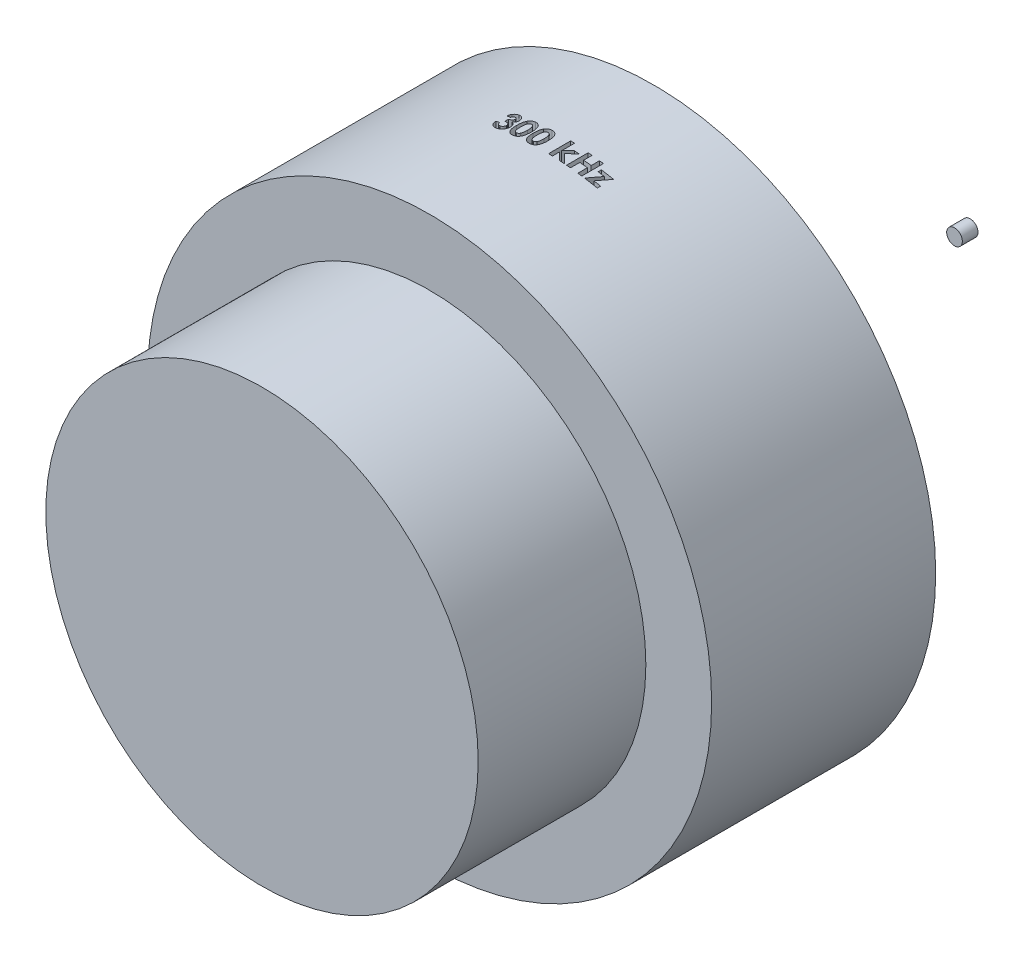
from build123d import *

# Parameters (mm, degrees)
SKETCH1_W          = 2.54
SKETCH1_H          = 1.27
CUT_EXTRUDE1_START = 50.8
CUT_EXTRUDE1_DEPTH = 12.7


with BuildPart() as part:
    # Sketch1 → Revolve1 (revolve)
    with BuildSketch(Plane(origin=(0, 0, 0), x_dir=(0, 0, -1), z_dir=(1, 0, 0)), mode=Mode.PRIVATE) as revolve1_sk:
        Polygon((0, 0), (0, 35.052), (27.178, 35.052), (27.178, 45.72), (63.5, 45.72), (63.5, 0), align=None)
        with Locations((113.538, 0.635)):
            Rectangle(SKETCH1_W, SKETCH1_H)
    revolve(revolve1_sk.sketch.rotate(Axis((0, 0, 0), (0, 0, -1)), 90), axis=Axis((0, 0, 0), (0, 0, -1)))

    # Sketch2 → Cut-Extrude1 (cut)
    # profile 1 of 6: a face of its own
    with BuildSketch(Plane(origin=(0, 0, 0), x_dir=(1, 0, 0), z_dir=(0, 1, 0)).offset(CUT_EXTRUDE1_START)):
        with BuildLine():
            Line((-7.673076923, 47.986435897), (-8.301282051, 47.986435897))
            add(Edge.make_bspline(
                [(-8.301282051, 47.986435897), (-8.296846684, 48.017837631), (-8.288151441, 48.079398649), (-8.267344886, 48.168523667), (-8.242458001, 48.253064846), (-8.211387998, 48.332754462), (-8.174947938, 48.407734468), (-8.133508376, 48.478262159), (-8.086621337, 48.544034816), (-8.050681924, 48.583656526), (-8.032752404, 48.603423077)],
                knots=[0, 0, 0, 0, 1.111473889, 2.178970933, 3.205615836, 4.199322666, 5.174200091, 6.12565194, 7.064921805, 8, 8, 8, 8], degree=3))
            add(Edge.make_bspline(
                [(-8.032752404, 48.603423077), (-8.006891447, 48.629503609), (-7.955922219, 48.680905597), (-7.870746661, 48.746745865), (-7.781466946, 48.80372614), (-7.68629253, 48.848900514), (-7.5867044, 48.885463936), (-7.481910595, 48.910023669), (-7.372339342, 48.926319269), (-7.297570746, 48.927924443), (-7.259415064, 48.92874359)],
                knots=[0, 0, 0, 0, 1.01925491, 2.00884431, 2.983262333, 3.955970413, 4.92937149, 5.924503185, 6.940838805, 8, 8, 8, 8], degree=3))
            add(Edge.make_bspline(
                [(-7.259415064, 48.92874359), (-7.2254927, 48.927942749), (-7.158808167, 48.926368458), (-7.060798684, 48.913730903), (-6.967354843, 48.891566039), (-6.877488917, 48.862585976), (-6.79252254, 48.823153758), (-6.710580422, 48.777381345), (-6.633952029, 48.721239579), (-6.562458065, 48.657805033), (-6.496777223, 48.589194362), (-6.439897326, 48.515855197), (-6.390996658, 48.439746596), (-6.350708976, 48.360236241), (-6.319733223, 48.27718959), (-6.298235132, 48.191086394), (-6.284164109, 48.102116644), (-6.282762268, 48.041645104), (-6.282051282, 48.01097516)],
                knots=[0, 0, 0, 0, 1.091422571, 2.145516843, 3.172569842, 4.178562979, 5.178154469, 6.181868002, 7.194278174, 8.227918432, 9.254613415, 10.245994977, 11.209837596, 12.161663635, 13.10878368, 14.055455738, 15.013766427, 16, 16, 16, 16], degree=3))
            add(Edge.make_bspline(
                [(-6.282051282, 48.01097516), (-6.283510267, 47.972992989), (-6.28638256, 47.898217771), (-6.309951806, 47.788778683), (-6.346844084, 47.684135386), (-6.400138568, 47.585751995), (-6.466770247, 47.493896255), (-6.548525086, 47.411639179), (-6.643074494, 47.337691089), (-6.714053994, 47.297951376), (-6.750400641, 47.277601763)],
                knots=[0, 0, 0, 0, 0.992805628, 1.954529043, 2.915727527, 3.886831945, 4.871318353, 5.87440735, 6.911542536, 8, 8, 8, 8], degree=3))
            add(Edge.make_bspline(
                [(-6.750400641, 47.277601763), (-6.72545286, 47.269410881), (-6.676431589, 47.253316166), (-6.606753746, 47.221617805), (-6.54049808, 47.186976752), (-6.478805488, 47.14673298), (-6.421062364, 47.102513768), (-6.367620717, 47.053941116), (-6.318161244, 47.001120934), (-6.273491353, 46.94376273), (-6.233845079, 46.882783839), (-6.198272588, 46.819592836), (-6.168994446, 46.753231418), (-6.144192214, 46.684457477), (-6.125309207, 46.61265291), (-6.112013882, 46.538095953), (-6.104328858, 46.460956675), (-6.103156761, 46.408694861), (-6.102564103, 46.382269231)],
                knots=[0, 0, 0, 0, 1.059543567, 2.081955587, 3.086750234, 4.076226789, 5.052108497, 6.020845489, 6.989030705, 7.970690546, 8.952259656, 9.923888338, 10.895517021, 11.877585046, 12.873342345, 13.889638361, 14.932918083, 16, 16, 16, 16], degree=3))
            add(Edge.make_bspline(
                [(-6.102564103, 46.382269231), (-6.103765501, 46.343434283), (-6.106134414, 46.266859676), (-6.121194854, 46.154073116), (-6.149234679, 46.046541152), (-6.186122622, 45.943026466), (-6.235327135, 45.844865394), (-6.293232574, 45.749805276), (-6.364409994, 45.661142768), (-6.443511474, 45.576533864), (-6.531358279, 45.499611238), (-6.626598507, 45.432922782), (-6.727137907, 45.375692221), (-6.833612563, 45.329230822), (-6.945985484, 45.29345023), (-7.0640062, 45.267586369), (-7.188170601, 45.251762431), (-7.27292252, 45.250103592), (-7.316205929, 45.24925641)],
                knots=[0, 0, 0, 0, 1.005138573, 1.981928558, 2.936866704, 3.876260664, 4.820238198, 5.773547, 6.751179199, 7.756627054, 8.768222608, 9.766606018, 10.760583154, 11.757261445, 12.767156078, 13.807575856, 14.880313354, 16, 16, 16, 16], degree=3))
            add(Edge.make_bspline(
                [(-7.316205929, 45.24925641), (-7.357151337, 45.25014962), (-7.437214662, 45.251896173), (-7.554324032, 45.267013474), (-7.665625403, 45.291398908), (-7.771402818, 45.325772198), (-7.871247032, 45.370348482), (-7.966063472, 45.423428835), (-8.053960097, 45.488074806), (-8.135916248, 45.561368157), (-8.21011389, 45.643599134), (-8.276429109, 45.732862899), (-8.333399643, 45.829498884), (-8.381259128, 45.933094222), (-8.419633412, 46.043830648), (-8.449902934, 46.161482976), (-8.471046691, 46.28628106), (-8.477486066, 46.372144797), (-8.480769231, 46.415923077)],
                knots=[0, 0, 0, 0, 1.066544725, 2.085487077, 3.070979577, 4.031932826, 4.977951092, 5.916076795, 6.857635327, 7.814973522, 8.776389752, 9.738577119, 10.707772778, 11.69409279, 12.707140348, 13.757286496, 14.856535458, 16, 16, 16, 16], degree=3))
            Line((-8.480769231, 46.415923077), (-7.852564103, 46.415923077))
            add(Edge.make_bspline(
                [(-7.852564103, 46.415923077), (-7.848583232, 46.393910783), (-7.840829443, 46.351036069), (-7.825706153, 46.288963013), (-7.805998396, 46.231665749), (-7.783211326, 46.17863502), (-7.75859786, 46.129174551), (-7.728858907, 46.085111038), (-7.696173581, 46.045247979), (-7.649008417, 45.997858334), (-7.581582567, 45.949167452), (-7.490535332, 45.906852759), (-7.389253904, 45.882051151), (-7.318448086, 45.87902543), (-7.281850962, 45.877461538)],
                knots=[0, 0, 0, 0, 0.928156231, 1.807827665, 2.648129825, 3.438902246, 4.202261636, 4.936546065, 5.639352463, 6.338805438, 7.70633318, 9.064371875, 10.482673459, 12, 12, 12, 12], degree=3))
            add(Edge.make_bspline(
                [(-7.281850962, 45.877461538), (-7.262431234, 45.877794555), (-7.224392331, 45.878446859), (-7.168518848, 45.885676775), (-7.115291488, 45.897584452), (-7.064611113, 45.913766545), (-7.016155088, 45.93405181), (-6.970849214, 45.960208445), (-6.927770045, 45.990619267), (-6.887385889, 46.024809104), (-6.850070097, 46.062063787), (-6.819021164, 46.10331702), (-6.790644685, 46.145237678), (-6.769657237, 46.190568358), (-6.751267712, 46.236869785), (-6.740012382, 46.285822556), (-6.7315138, 46.336399774), (-6.731019897, 46.371012602), (-6.730769231, 46.388579327)],
                knots=[0, 0, 0, 0, 1.110435564, 2.175094844, 3.216326037, 4.226890168, 5.215276772, 6.21526065, 7.213097102, 8.228249917, 9.239874822, 10.221364777, 11.178138315, 12.128914389, 13.072518965, 14.022636769, 14.996447288, 16, 16, 16, 16], degree=3))
            add(Edge.make_bspline(
                [(-6.730769231, 46.388579327), (-6.731434703, 46.407791534), (-6.732759505, 46.446038636), (-6.743583276, 46.50185224), (-6.760676299, 46.555540428), (-6.784420596, 46.606865444), (-6.816128458, 46.655638115), (-6.853543382, 46.702836968), (-6.899613044, 46.746005386), (-6.950157633, 46.788676059), (-7.0087695, 46.825872017), (-7.072594165, 46.860198421), (-7.143309038, 46.887511641), (-7.219187908, 46.911907405), (-7.301666093, 46.929725692), (-7.390231434, 46.942663506), (-7.484741063, 46.952293703), (-7.549887778, 46.953675313), (-7.583333333, 46.954384615)],
                knots=[0, 0, 0, 0, 0.809814727, 1.612155564, 2.388397, 3.182215007, 3.988903953, 4.837162975, 5.715530372, 6.646997145, 7.623086902, 8.637258368, 9.698941581, 10.815059213, 11.996518529, 13.252603015, 14.589518788, 16, 16, 16, 16], degree=3))
            Line((-7.583333333, 46.954384615), (-7.583333333, 47.537717949))
            add(Edge.make_bspline(
                [(-7.583333333, 47.537717949), (-7.541691628, 47.54126429), (-7.463788243, 47.547898791), (-7.355654168, 47.563413803), (-7.264619216, 47.584152172), (-7.188495361, 47.609171891), (-7.125286989, 47.641303729), (-7.070068504, 47.676775858), (-7.022511733, 47.717971553), (-6.982319881, 47.763662363), (-6.950167651, 47.812730008), (-6.927412175, 47.864411832), (-6.912385648, 47.917108735), (-6.910961886, 47.953151828), (-6.91025641, 47.971011218)],
                knots=[0, 0, 0, 0, 1.70044513, 3.18119609, 4.440695891, 5.496282586, 6.431922213, 7.318171381, 8.16090191, 8.983045123, 9.787564368, 10.536848927, 11.275007137, 12, 12, 12, 12], degree=3))
            add(Edge.make_bspline(
                [(-6.91025641, 47.971011218), (-6.911473558, 47.99379786), (-6.913849172, 48.038272562), (-6.932299479, 48.101925229), (-6.964327122, 48.158666306), (-7.007270567, 48.208376394), (-7.059598648, 48.249897985), (-7.120936333, 48.280041952), (-7.189952589, 48.297752878), (-7.238509244, 48.299588905), (-7.263621795, 48.300538462)],
                knots=[0, 0, 0, 0, 1.009664648, 1.970651636, 2.907870547, 3.878035693, 4.867062054, 5.849714035, 6.887914197, 8, 8, 8, 8], degree=3))
            add(Edge.make_bspline(
                [(-7.263621795, 48.300538462), (-7.286383499, 48.299418084), (-7.331549692, 48.297194913), (-7.397596184, 48.280601749), (-7.460318348, 48.252669222), (-7.518417384, 48.214151914), (-7.57105462, 48.16789426), (-7.614254604, 48.11311167), (-7.650186303, 48.053086265), (-7.665416804, 48.008739782), (-7.673076923, 47.986435897)],
                knots=[0, 0, 0, 0, 0.98818071, 1.960853194, 2.938124878, 3.957524365, 4.978590984, 5.968022688, 6.978025184, 8, 8, 8, 8], degree=3))
        make_face()
    # profile 2 of 6: a face of its own
    with BuildSketch(Plane(origin=(0, 0, 0), x_dir=(1, 0, 0), z_dir=(0, 1, 0)).offset(CUT_EXTRUDE1_START)):
        with BuildLine():
            add(Edge.make_bspline(
                [(-4.609875801, 48.92874359), (-4.579468066, 48.928292178), (-4.519678333, 48.927404583), (-4.431619312, 48.917791201), (-4.346794127, 48.903268063), (-4.264870933, 48.883013349), (-4.186439421, 48.856206957), (-4.11092875, 48.824120165), (-4.039237715, 48.785069956), (-3.970452027, 48.740960738), (-3.904598183, 48.691022851), (-3.843258932, 48.63409108), (-3.785314091, 48.57147543), (-3.732017951, 48.502229263), (-3.682190253, 48.426982447), (-3.635994724, 48.34572305), (-3.593785, 48.258053361), (-3.555088012, 48.163815174), (-3.520485043, 48.061595899), (-3.491339005, 47.950223037), (-3.466341401, 47.829671153), (-3.445241659, 47.699640176), (-3.429293664, 47.559957264), (-3.418544395, 47.410715214), (-3.411167738, 47.252201744), (-3.410565706, 47.143462806), (-3.41025641, 47.087597756)],
                knots=[0, 0, 0, 0, 0.879237366, 1.728815576, 2.559023295, 3.367336655, 4.166867292, 4.954216142, 5.737608147, 6.525189134, 7.316157332, 8.124696809, 8.942788509, 9.781158001, 10.649253743, 11.551476218, 12.482711956, 13.461909668, 14.496590415, 15.601789533, 16.789733467, 18.056700938, 19.410929216, 20.8549011, 22.384193279, 24, 24, 24, 24], degree=3))
            add(Edge.make_bspline(
                [(-3.41025641, 47.087597756), (-3.410590676, 47.031033772), (-3.411240147, 46.921130965), (-3.418237745, 46.76116765), (-3.43028794, 46.610842014), (-3.4458191, 46.470169608), (-3.467092541, 46.339224719), (-3.492006698, 46.217668289), (-3.521612798, 46.105544378), (-3.557355577, 46.003105625), (-3.595818331, 45.908701935), (-3.638143517, 45.821203181), (-3.683593411, 45.740372369), (-3.731125532, 45.664990055), (-3.783345763, 45.597278471), (-3.8377124, 45.534935071), (-3.896592662, 45.480334593), (-3.957507464, 45.430663175), (-4.02268836, 45.387737102), (-4.091463158, 45.350194666), (-4.165057992, 45.319743291), (-4.242131354, 45.293258312), (-4.323996975, 45.274244955), (-4.409354021, 45.25915848), (-4.499166157, 45.250820769), (-4.560313876, 45.249786421), (-4.591646635, 45.24925641)],
                knots=[0, 0, 0, 0, 1.643780988, 3.193836972, 4.651895693, 6.025988579, 7.305620092, 8.505800249, 9.631074763, 10.672816429, 11.65661981, 12.592235626, 13.49536222, 14.350718032, 15.179365177, 15.97804903, 16.751647189, 17.51006938, 18.259804725, 19.016521909, 19.783502495, 20.571750527, 21.382245291, 22.22305063, 23.089471752, 24, 24, 24, 24], degree=3))
            add(Edge.make_bspline(
                [(-4.591646635, 45.24925641), (-4.622978548, 45.249796645), (-4.684357304, 45.250854957), (-4.774412301, 45.259096486), (-4.860221696, 45.27430607), (-4.942735006, 45.293404282), (-5.021377949, 45.31968469), (-5.096527618, 45.351047148), (-5.167606175, 45.388355338), (-5.234810426, 45.431381425), (-5.297910916, 45.480720504), (-5.357888228, 45.535844838), (-5.414609687, 45.596614701), (-5.467212419, 45.663710765), (-5.516557906, 45.736237439), (-5.562131551, 45.815022941), (-5.603905967, 45.899952561), (-5.643187864, 45.991144684), (-5.67731886, 46.09056257), (-5.707693862, 46.199094009), (-5.732576264, 46.3176437), (-5.752588358, 46.446173557), (-5.768566001, 46.584411285), (-5.780451532, 46.732423606), (-5.787487998, 46.890279462), (-5.788130659, 46.998781655), (-5.788461538, 47.054645032)],
                knots=[0, 0, 0, 0, 0.917216111, 1.796812873, 2.643793957, 3.46689424, 4.273913431, 5.068098542, 5.848489301, 6.620921603, 7.401012384, 8.190319798, 9.003608147, 9.831726257, 10.68377682, 11.569763213, 12.493818149, 13.453288342, 14.474581811, 15.568529029, 16.750744269, 18.018426408, 19.375425659, 20.823733699, 22.36466933, 24, 24, 24, 24], degree=3))
            add(Edge.make_bspline(
                [(-5.788461538, 47.054645032), (-5.787862181, 47.132262797), (-5.786705712, 47.282027275), (-5.772050092, 47.498393402), (-5.750539358, 47.698386406), (-5.718945186, 47.881671749), (-5.679879429, 48.048928265), (-5.629853693, 48.199054156), (-5.572903032, 48.334126752), (-5.524373752, 48.414144571), (-5.501001603, 48.452681891)],
                knots=[0, 0, 0, 0, 1.288568992, 2.486310467, 3.599230591, 4.627010532, 5.572937695, 6.447898582, 7.252493626, 8, 8, 8, 8], degree=3))
            add(Edge.make_bspline(
                [(-5.501001603, 48.452681891), (-5.473825581, 48.490540942), (-5.420691103, 48.564562848), (-5.327783983, 48.661739774), (-5.227967379, 48.744850239), (-5.119191115, 48.81201338), (-5.003175533, 48.864978238), (-4.878924579, 48.902386721), (-4.746897092, 48.924182647), (-4.656231615, 48.927200572), (-4.609875801, 48.92874359)],
                knots=[0, 0, 0, 0, 1.058512271, 2.069600068, 3.047294572, 4.004278952, 4.967380941, 5.939006123, 6.946246673, 8, 8, 8, 8], degree=3))
        make_face()
        with BuildLine():
            add(Edge.make_bspline(
                [(-4.594451122, 48.300538462), (-4.621939967, 48.299235545), (-4.675832695, 48.296681137), (-4.754033612, 48.274997815), (-4.827772194, 48.241506756), (-4.883863163, 48.201205503), (-4.925846696, 48.162571918), (-4.955180892, 48.127609781), (-4.9834691, 48.088594555), (-5.00845467, 48.043765685), (-5.03204757, 47.994733924), (-5.055104945, 47.941276698), (-5.074005938, 47.882080981), (-5.092575663, 47.818154885), (-5.108844474, 47.747731022), (-5.122474171, 47.670233756), (-5.134651108, 47.585159114), (-5.143144666, 47.492451372), (-5.151063212, 47.392207526), (-5.1567396, 47.284204271), (-5.159112756, 47.168470744), (-5.159867109, 47.088766781), (-5.16025641, 47.047633814)],
                knots=[0, 0, 0, 0, 1.076674018, 2.110852608, 3.161083442, 4.239746716, 4.804137807, 5.395870207, 6.026861976, 6.692161227, 7.405688833, 8.16177676, 8.973626916, 9.841385931, 10.773283133, 11.807421078, 12.927755683, 14.143907515, 15.458935494, 16.872852025, 18.386167141, 20, 20, 20, 20], degree=3))
            add(Edge.make_bspline(
                [(-5.16025641, 47.047633814), (-5.159615668, 46.994344067), (-5.158386998, 46.892157026), (-5.151951799, 46.745208503), (-5.139052977, 46.611473515), (-5.123009446, 46.490045689), (-5.100475651, 46.381712518), (-5.074549062, 46.28544907), (-5.04253203, 46.20248247), (-5.00553018, 46.131612834), (-4.964548964, 46.071324181), (-4.920062051, 46.020078555), (-4.873584062, 45.975702261), (-4.823664266, 45.939655944), (-4.770421758, 45.912031708), (-4.714301015, 45.892161936), (-4.655266373, 45.879998822), (-4.614840059, 45.878312189), (-4.594451122, 45.877461538)],
                knots=[0, 0, 0, 0, 1.771748488, 3.397459088, 4.888034009, 6.237357457, 7.467047327, 8.564189669, 9.548206622, 10.417051504, 11.216568818, 11.965764335, 12.669334354, 13.348544111, 14.005342236, 14.656555988, 15.322436492, 16, 16, 16, 16], degree=3))
            add(Edge.make_bspline(
                [(-4.594451122, 45.877461538), (-4.574761868, 45.878043617), (-4.536212759, 45.879183253), (-4.479999523, 45.890881469), (-4.426840293, 45.909900227), (-4.376895573, 45.936803595), (-4.329986718, 45.971015344), (-4.286342989, 46.012685815), (-4.246293539, 46.062230366), (-4.222960547, 46.098999749), (-4.2109375, 46.117946314)],
                knots=[0, 0, 0, 0, 0.992283464, 1.942767638, 2.88273346, 3.832339453, 4.79467288, 5.803907806, 6.868395428, 8, 8, 8, 8], degree=3))
            add(Edge.make_bspline(
                [(-4.2109375, 46.117946314), (-4.196782387, 46.143836189), (-4.167100263, 46.198125158), (-4.132752057, 46.289735767), (-4.103839652, 46.393057394), (-4.078955168, 46.508411585), (-4.061935699, 46.63625331), (-4.047278553, 46.775771915), (-4.040209047, 46.927669958), (-4.039059153, 47.03290547), (-4.038461538, 47.087597756)],
                knots=[0, 0, 0, 0, 0.710965849, 1.490837728, 2.352621235, 3.297892224, 4.334225155, 5.461620853, 6.680770821, 8, 8, 8, 8], degree=3))
            add(Edge.make_bspline(
                [(-4.038461538, 47.087597756), (-4.038692384, 47.142764798), (-4.039136723, 47.248951935), (-4.04728905, 47.401396063), (-4.058641788, 47.540628473), (-4.075247567, 47.666338316), (-4.096613919, 47.778830761), (-4.122948029, 47.878098454), (-4.153993986, 47.964337033), (-4.19081079, 48.037460505), (-4.231587689, 48.099605426), (-4.274873612, 48.152920947), (-4.32085159, 48.198440394), (-4.369444732, 48.236335064), (-4.421777743, 48.265289435), (-4.476850996, 48.285733616), (-4.534777394, 48.298101659), (-4.574291398, 48.299715231), (-4.594451122, 48.300538462)],
                knots=[0, 0, 0, 0, 1.793836731, 3.452829483, 4.963243077, 6.335886805, 7.574563692, 8.684454726, 9.672768357, 10.54971625, 11.340229787, 12.085688095, 12.778991901, 13.440269426, 14.083255152, 14.715733572, 15.344777694, 16, 16, 16, 16], degree=3))
        make_face(mode=Mode.SUBTRACT)
    # profile 3 of 6: a face of its own
    with BuildSketch(Plane(origin=(0, 0, 0), x_dir=(1, 0, 0), z_dir=(0, 1, 0)).offset(CUT_EXTRUDE1_START)):
        with BuildLine():
            add(Edge.make_bspline(
                [(-1.917568109, 48.92874359), (-1.887160373, 48.928292178), (-1.827370641, 48.927404583), (-1.739311619, 48.917791201), (-1.654486435, 48.903268063), (-1.572563241, 48.883013349), (-1.494131729, 48.856206957), (-1.418621058, 48.824120165), (-1.346930023, 48.785069956), (-1.278144335, 48.740960738), (-1.21229049, 48.691022851), (-1.15095124, 48.63409108), (-1.093006398, 48.57147543), (-1.039710259, 48.502229263), (-0.989882561, 48.426982447), (-0.943687031, 48.34572305), (-0.901477308, 48.258053361), (-0.86278032, 48.163815174), (-0.828177351, 48.061595899), (-0.799031313, 47.950223037), (-0.774033709, 47.829671153), (-0.752933967, 47.699640176), (-0.736985972, 47.559957264), (-0.726236703, 47.410715214), (-0.718860045, 47.252201744), (-0.718258014, 47.143462806), (-0.717948718, 47.087597756)],
                knots=[0, 0, 0, 0, 0.879237366, 1.728815576, 2.559023295, 3.367336655, 4.166867292, 4.954216142, 5.737608147, 6.525189134, 7.316157332, 8.124696809, 8.942788509, 9.781158001, 10.649253743, 11.551476218, 12.482711956, 13.461909668, 14.496590415, 15.601789533, 16.789733467, 18.056700938, 19.410929216, 20.8549011, 22.384193279, 24, 24, 24, 24], degree=3))
            add(Edge.make_bspline(
                [(-0.717948718, 47.087597756), (-0.718282983, 47.031033772), (-0.718932455, 46.921130965), (-0.725930053, 46.76116765), (-0.737980247, 46.610842014), (-0.753511408, 46.470169608), (-0.774784849, 46.339224719), (-0.799699006, 46.217668289), (-0.829305105, 46.105544378), (-0.865047885, 46.003105625), (-0.903510639, 45.908701935), (-0.945835825, 45.821203181), (-0.991285719, 45.740372369), (-1.038817839, 45.664990055), (-1.091038071, 45.597278471), (-1.145404707, 45.534935071), (-1.20428497, 45.480334593), (-1.265199772, 45.430663175), (-1.330380668, 45.387737102), (-1.399155466, 45.350194666), (-1.4727503, 45.319743291), (-1.549823662, 45.293258312), (-1.631689283, 45.274244955), (-1.717046329, 45.25915848), (-1.806858464, 45.250820769), (-1.868006184, 45.249786421), (-1.899338942, 45.24925641)],
                knots=[0, 0, 0, 0, 1.643780988, 3.193836972, 4.651895693, 6.025988579, 7.305620092, 8.505800249, 9.631074763, 10.672816429, 11.65661981, 12.592235626, 13.49536222, 14.350718032, 15.179365177, 15.97804903, 16.751647189, 17.51006938, 18.259804725, 19.016521909, 19.783502495, 20.571750527, 21.382245291, 22.22305063, 23.089471752, 24, 24, 24, 24], degree=3))
            add(Edge.make_bspline(
                [(-1.899338942, 45.24925641), (-1.930670855, 45.249796645), (-1.992049612, 45.250854957), (-2.082104608, 45.259096486), (-2.167914004, 45.27430607), (-2.250427314, 45.293404282), (-2.329070257, 45.31968469), (-2.404219925, 45.351047148), (-2.475298482, 45.388355338), (-2.542502733, 45.431381425), (-2.605603224, 45.480720504), (-2.665580535, 45.535844838), (-2.722301994, 45.596614701), (-2.774904727, 45.663710765), (-2.824250214, 45.736237439), (-2.869823859, 45.815022941), (-2.911598275, 45.899952561), (-2.950880172, 45.991144684), (-2.985011168, 46.09056257), (-3.01538617, 46.199094009), (-3.040268572, 46.3176437), (-3.060280665, 46.446173557), (-3.076258309, 46.584411285), (-3.088143839, 46.732423606), (-3.095180306, 46.890279462), (-3.095822966, 46.998781655), (-3.096153846, 47.054645032)],
                knots=[0, 0, 0, 0, 0.917216111, 1.796812873, 2.643793957, 3.46689424, 4.273913431, 5.068098542, 5.848489301, 6.620921603, 7.401012384, 8.190319798, 9.003608147, 9.831726257, 10.68377682, 11.569763213, 12.493818149, 13.453288342, 14.474581811, 15.568529029, 16.750744269, 18.018426408, 19.375425659, 20.823733699, 22.36466933, 24, 24, 24, 24], degree=3))
            add(Edge.make_bspline(
                [(-3.096153846, 47.054645032), (-3.095554488, 47.132262797), (-3.09439802, 47.282027275), (-3.079742399, 47.498393402), (-3.058231666, 47.698386406), (-3.026637494, 47.881671749), (-2.987571737, 48.048928265), (-2.937546001, 48.199054156), (-2.880595339, 48.334126752), (-2.83206606, 48.414144571), (-2.80869391, 48.452681891)],
                knots=[0, 0, 0, 0, 1.288568992, 2.486310467, 3.599230591, 4.627010532, 5.572937695, 6.447898582, 7.252493626, 8, 8, 8, 8], degree=3))
            add(Edge.make_bspline(
                [(-2.80869391, 48.452681891), (-2.781517888, 48.490540942), (-2.72838341, 48.564562848), (-2.635476291, 48.661739774), (-2.535659687, 48.744850239), (-2.426883423, 48.81201338), (-2.31086784, 48.864978238), (-2.186616887, 48.902386721), (-2.0545894, 48.924182647), (-1.963923923, 48.927200572), (-1.917568109, 48.92874359)],
                knots=[0, 0, 0, 0, 1.058512271, 2.069600068, 3.047294572, 4.004278952, 4.967380941, 5.939006123, 6.946246673, 8, 8, 8, 8], degree=3))
        make_face()
        with BuildLine():
            add(Edge.make_bspline(
                [(-1.902143429, 48.300538462), (-1.929632275, 48.299235545), (-1.983525003, 48.296681137), (-2.06172592, 48.274997815), (-2.135464501, 48.241506756), (-2.191555471, 48.201205503), (-2.233539004, 48.162571918), (-2.2628732, 48.127609781), (-2.291161408, 48.088594555), (-2.316146978, 48.043765685), (-2.339739878, 47.994733924), (-2.362797253, 47.941276698), (-2.381698246, 47.882080981), (-2.40026797, 47.818154885), (-2.416536782, 47.747731022), (-2.430166479, 47.670233756), (-2.442343416, 47.585159114), (-2.450836974, 47.492451372), (-2.458755519, 47.392207526), (-2.464431908, 47.284204271), (-2.466805063, 47.168470744), (-2.467559417, 47.088766781), (-2.467948718, 47.047633814)],
                knots=[0, 0, 0, 0, 1.076674018, 2.110852608, 3.161083442, 4.239746716, 4.804137807, 5.395870207, 6.026861976, 6.692161227, 7.405688833, 8.16177676, 8.973626916, 9.841385931, 10.773283133, 11.807421078, 12.927755683, 14.143907515, 15.458935494, 16.872852025, 18.386167141, 20, 20, 20, 20], degree=3))
            add(Edge.make_bspline(
                [(-2.467948718, 47.047633814), (-2.467307976, 46.994344067), (-2.466079306, 46.892157026), (-2.459644107, 46.745208503), (-2.446745284, 46.611473515), (-2.430701753, 46.490045689), (-2.408167959, 46.381712518), (-2.38224137, 46.28544907), (-2.350224338, 46.20248247), (-2.313222488, 46.131612834), (-2.272241272, 46.071324181), (-2.227754359, 46.020078555), (-2.181276369, 45.975702261), (-2.131356574, 45.939655944), (-2.078114066, 45.912031708), (-2.021993323, 45.892161936), (-1.962958681, 45.879998822), (-1.922532367, 45.878312189), (-1.902143429, 45.877461538)],
                knots=[0, 0, 0, 0, 1.771748488, 3.397459088, 4.888034009, 6.237357457, 7.467047327, 8.564189669, 9.548206622, 10.417051504, 11.216568818, 11.965764335, 12.669334354, 13.348544111, 14.005342236, 14.656555988, 15.322436492, 16, 16, 16, 16], degree=3))
            add(Edge.make_bspline(
                [(-1.902143429, 45.877461538), (-1.882454176, 45.878043617), (-1.843905066, 45.879183253), (-1.787691831, 45.890881469), (-1.734532601, 45.909900227), (-1.684587881, 45.936803595), (-1.637679026, 45.971015344), (-1.594035297, 46.012685815), (-1.553985846, 46.062230366), (-1.530652855, 46.098999749), (-1.518629808, 46.117946314)],
                knots=[0, 0, 0, 0, 0.992283464, 1.942767638, 2.88273346, 3.832339453, 4.79467288, 5.803907806, 6.868395428, 8, 8, 8, 8], degree=3))
            add(Edge.make_bspline(
                [(-1.518629808, 46.117946314), (-1.504474695, 46.143836189), (-1.47479257, 46.198125158), (-1.440444365, 46.289735767), (-1.41153196, 46.393057394), (-1.386647476, 46.508411585), (-1.369628007, 46.63625331), (-1.35497086, 46.775771915), (-1.347901355, 46.927669958), (-1.346751461, 47.03290547), (-1.346153846, 47.087597756)],
                knots=[0, 0, 0, 0, 0.710965849, 1.490837728, 2.352621235, 3.297892224, 4.334225155, 5.461620853, 6.680770821, 8, 8, 8, 8], degree=3))
            add(Edge.make_bspline(
                [(-1.346153846, 47.087597756), (-1.346384692, 47.142764798), (-1.34682903, 47.248951935), (-1.354981357, 47.401396063), (-1.366334096, 47.540628473), (-1.382939874, 47.666338316), (-1.404306227, 47.778830761), (-1.430640337, 47.878098454), (-1.461686293, 47.964337033), (-1.498503098, 48.037460505), (-1.539279997, 48.099605426), (-1.58256592, 48.152920947), (-1.628543897, 48.198440394), (-1.677137039, 48.236335064), (-1.729470051, 48.265289435), (-1.784543304, 48.285733616), (-1.842469701, 48.298101659), (-1.881983705, 48.299715231), (-1.902143429, 48.300538462)],
                knots=[0, 0, 0, 0, 1.793836731, 3.452829483, 4.963243077, 6.335886805, 7.574563692, 8.684454726, 9.672768357, 10.54971625, 11.340229787, 12.085688095, 12.778991901, 13.440269426, 14.083255152, 14.715733572, 15.344777694, 16, 16, 16, 16], degree=3))
        make_face(mode=Mode.SUBTRACT)
    # profile 4 of 6: a face of its own
    with BuildSketch(Plane(origin=(0, 0, 0), x_dir=(1, 0, 0), z_dir=(0, 1, 0)).offset(CUT_EXTRUDE1_START)):
        Polygon((1.121794872, 48.92874359), (1.75, 48.92874359), (1.75, 46.83519391), (2.727363782, 47.896692308), (3.503505609, 47.896692308), (2.381009615, 46.677441506), (3.6640625, 45.339), (2.873197115, 45.339), (1.75, 46.510574519), (1.75, 45.339), (1.121794872, 45.339), align=None)
    # profile 5 of 6: a face of its own
    with BuildSketch(Plane(origin=(0, 0, 0), x_dir=(1, 0, 0), z_dir=(0, 1, 0)).offset(CUT_EXTRUDE1_START)):
        Polygon((4.038461538, 48.839), (4.666666667, 48.839), (4.666666667, 47.492846154), (5.878205128, 47.492846154), (5.878205128, 48.839), (6.506410256, 48.839), (6.506410256, 45.339), (5.878205128, 45.339), (5.878205128, 46.864641026), (4.666666667, 46.864641026), (4.666666667, 45.339), (4.038461538, 45.339), align=None)
    # profile 6 of 6: a face of its own
    with BuildSketch(Plane(origin=(0, 0, 0), x_dir=(1, 0, 0), z_dir=(0, 1, 0)).offset(CUT_EXTRUDE1_START)):
        Polygon((7.134615385, 47.896692308), (9.108974359, 47.896692308), (7.932491987, 45.877461538), (9.019230769, 45.877461538), (9.019230769, 45.339), (6.955128205, 45.339), (8.131610577, 47.358230769), (7.134615385, 47.358230769), align=None)
    extrude(amount=-CUT_EXTRUDE1_DEPTH, mode=Mode.SUBTRACT)


solid = part.part
